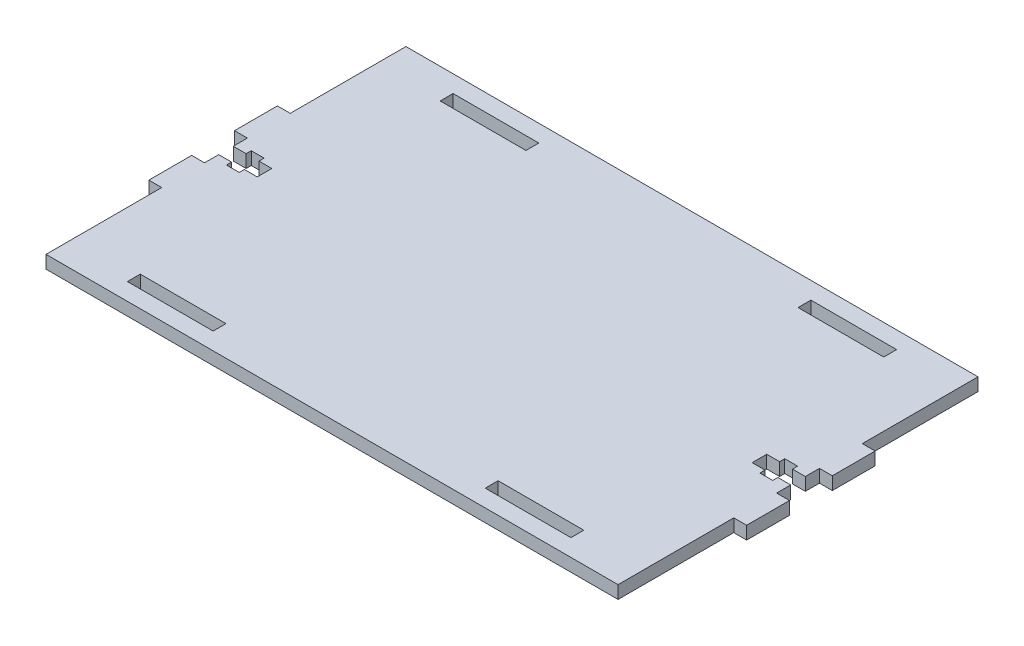
from build123d import *

# Parameters (mm, degrees)
SKETCH1_W           = 133.500000388
SKETCH1_H           = 84
BOSS_EXTRUDE1_DEPTH = 3
SKETCH2_W           = 20
SKETCH2_H           = 3
CUT_EXTRUDE1_DEPTH  = 104.014399147
SKETCH3_W           = 3
SKETCH3_H           = 30
BOSS_EXTRUDE2_DEPTH = 3
SKETCH4_W           = 3
SKETCH4_H           = 3.4
CUT_EXTRUDE2_DEPTH  = 106.612611798


with BuildPart() as part:
    # Sketch1 → Boss-Extrude1 (new body)
    with BuildSketch(Plane(origin=(0, 0, 0), x_dir=(1, 0, 0), z_dir=(0, 1, 0))):
        with Locations((22.092889694, -10.056770433)):
            Rectangle(SKETCH1_W, SKETCH1_H)
    extrude(amount=BOSS_EXTRUDE1_DEPTH)

    # Sketch2 → Cut-Extrude1 (cut, through all)
    with BuildSketch(Plane.XZ):
        with Locations((63.842889888, 46.556770433)):
            Rectangle(SKETCH2_W, SKETCH2_H)
        with Locations((-19.6571105, 46.556770433)):
            Rectangle(SKETCH2_W, SKETCH2_H)
        with Locations((-19.6571105, -26.443229567)):
            Rectangle(SKETCH2_W, SKETCH2_H)
        with Locations((63.842889888, -26.443229567)):
            Rectangle(SKETCH2_W, SKETCH2_H)
    extrude(amount=-CUT_EXTRUDE1_DEPTH, mode=Mode.SUBTRACT)

    # Sketch3 → Boss-Extrude2 (add, through all)
    with BuildSketch(Plane.XZ):
        with Locations((90.342889888, 10.056770433)):
            Rectangle(SKETCH3_W, SKETCH3_H)
        with Locations((-46.1571105, 10.056770433)):
            Rectangle(SKETCH3_W, SKETCH3_H)
    extrude(amount=-BOSS_EXTRUDE2_DEPTH)

    # Sketch4 → Cut-Extrude2 (cut, symmetric)
    with BuildSketch(Plane.XZ):
        Polygon((88.842889888, 8.356770433), (88.842889888, 5.056770433), (91.842889888, 5.056770433), (91.842889888, 15.056770433), (88.842889888, 15.056770433), (88.842889888, 11.756770433), align=None)
        with Locations((87.342889888, 10.056770433)):
            Rectangle(SKETCH4_W, SKETCH4_H)
        Polygon((85.842889888, 7.156770433), (85.842889888, 8.356770433), (85.842889888, 11.756770433), (85.842889888, 12.956770433), (82.842889888, 12.956770433), (82.842889888, 11.756770433), (82.842889888, 8.356770433), (82.842889888, 7.156770433), align=None)
        with Locations((81.342889888, 10.056770433)):
            Rectangle(SKETCH4_W, SKETCH4_H)
    cut_extrude2 = extrude(amount=CUT_EXTRUDE2_DEPTH, both=True, mode=Mode.SUBTRACT)

    # Mirror1: Cut-Extrude2 across plane
    add(cut_extrude2.mirror(Plane(origin=(22.092889694, 0, 0), x_dir=(0, 0, 1), z_dir=(1, 0, 0))), mode=Mode.SUBTRACT)


solid = part.part
